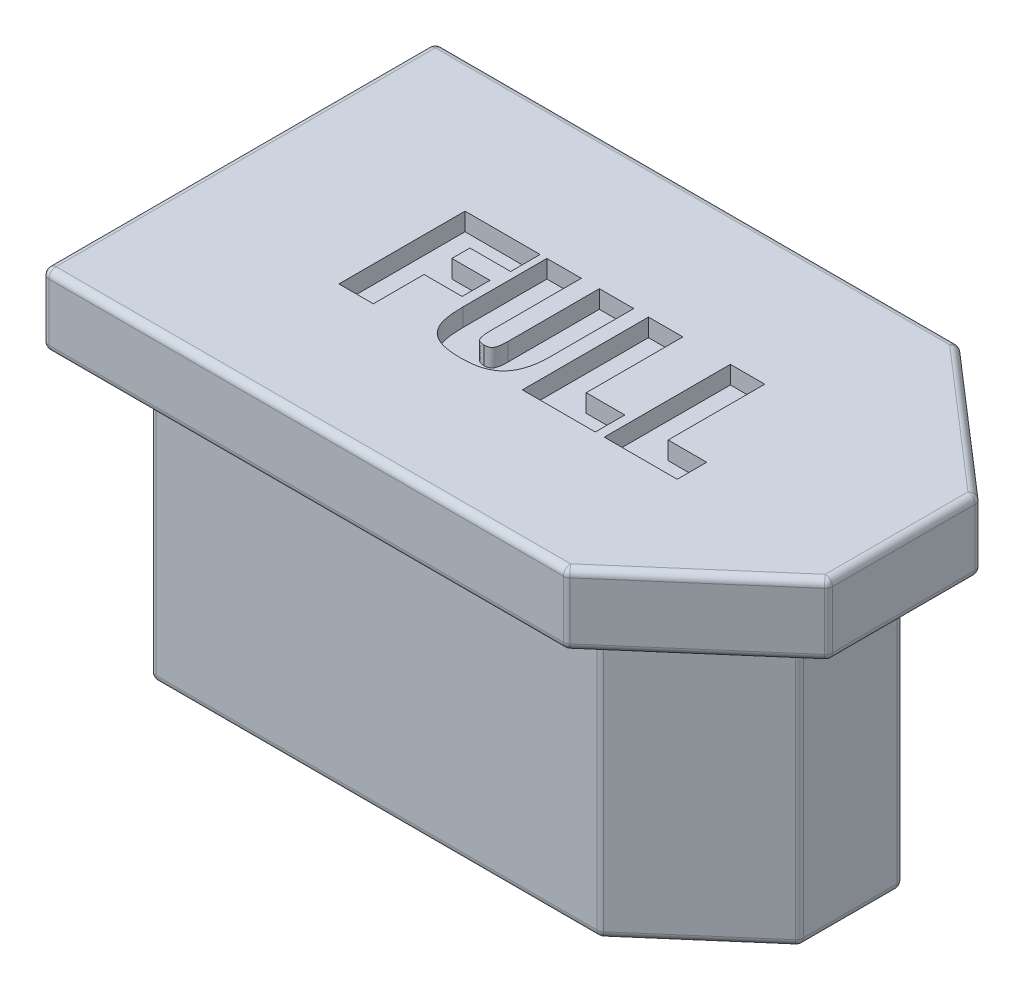
from build123d import *

# Parameters (mm, degrees)
BOSS_EXTRUDE1_DEPTH = 4
SHELL1_T            = -0.7
BOSS_EXTRUDE2_DEPTH = 2
BOSS_EXTRUDE4_REACH = 16.722
SKETCH4_W           = 2
SKETCH4_H           = 1.2
SKETCH5_W           = 1.1
SKETCH5_H           = 4
CUT_EXTRUDE1_DEPTH  = 1
FILLET1_R           = 0.2
CUT_EXTRUDE2_DEPTH  = 0.5


with BuildPart() as part:
    # Sketch1 → Boss-Extrude1 (new, symmetric)
    with BuildSketch(Plane(origin=(0, 0, 0), x_dir=(1, 0, 0), z_dir=(0, 1, 0))):
        Polygon((-7.800231879, 4), (4.799768121, 4), (7.800231879, 1.4), (7.800231879, -1.4), (4.799768121, -4), (-7.800231879, -4), align=None)
    extrude(amount=BOSS_EXTRUDE1_DEPTH, both=True)

    # Shell1
    shell1_openings = [part.faces().sort_by_distance(p)[0] for p in [
        (-0.453398861, 4, 0),
        (-0.453398861, -4, 0),
    ]]
    offset(amount=SHELL1_T, openings=shell1_openings, kind=Kind.INTERSECTION)

    # Sketch2 → Boss-Extrude2 (add)
    with BuildSketch(Plane(origin=(0, 4, 0), x_dir=(1, 0, 0), z_dir=(0, 1, 0))):
        Polygon((-9.300231879, 5.5), (-9.300231879, -5.5), (5.359252751, -5.5), (9.300231879, -2.085012665), (9.300231879, 2.085012665), (5.359252751, 5.5), align=None)
    extrude(amount=BOSS_EXTRUDE2_DEPTH)

    # Sketch4 → Boss-Extrude4 (add, up to next)
    with BuildSketch(Plane.XZ.offset(4), mode=Mode.PRIVATE) as boss_extrude4_sk1:
        with Locations((-0.100231879, -2.7)):
            Rectangle(SKETCH4_W, SKETCH4_H)
    boss_extrude4_tool1 = extrude(boss_extrude4_sk1.sketch, amount=-BOSS_EXTRUDE4_REACH, mode=Mode.PRIVATE) - part.part
    add(boss_extrude4_tool1.solids().sort_by_distance((-0.100232, -4, -2.7))[0])

    # Sketch5 → Cut-Extrude1 (cut)
    with BuildSketch(Plane.XZ.offset(-4)):
        with Locations((-0.100231879, -0.1)):
            Rectangle(SKETCH5_W, SKETCH5_H)
    extrude(amount=-CUT_EXTRUDE1_DEPTH, mode=Mode.SUBTRACT)

    # Fillet1
    fillet1_edges = [part.edges().sort_by_distance(p)[0] for p in [
        (6.3, 4, 2.7),
        (-7.800231879, 0, -4),
        (4.799768121, 0, -4),
        (7.800231879, 0, -1.4),
        (7.800231879, 0, 1.4),
        (4.799768121, 0, 4),
        (-7.800231879, 0, 4),
        (7.800231879, 4, 0),
        (6.3, 4, -2.7),
        (-1.500231879, 4, -4),
        (-7.100231879, -4, 0),
        (-7.100231879, 0, -3.3),
        (-1.280778293, -4, 3.3),
        (-7.100231879, 0, 3.3),
        (5.819453586, -4, 2.190163711),
        (4.538675293, 0, 3.3),
        (7.100231879, -4, 0),
        (7.100231879, 0, 1.080327423),
        (5.819453586, -4, -2.190163711),
        (7.100231879, 0, -1.080327423),
        (2.719221707, -4, -3.3),
        (4.538675293, 0, -3.3),
        (-7.100231879, 4, 0),
        (-1.280778293, 4, 3.3),
        (5.819453586, 4, 2.190163711),
        (7.100231879, 4, 0),
        (5.819453586, 4, -2.190163711),
        (2.719221707, 4, -3.3),
        (-1.970489564, 4, -5.5),
        (5.359252751, 5, -5.5),
        (-9.300231879, 4, 0),
        (-9.300231879, 5, -5.5),
        (-1.970489564, 4, 5.5),
        (-9.300231879, 5, 5.5),
        (7.329742315, 4, 3.792506333),
        (5.359252751, 5, 5.5),
        (9.300231879, 4, 0),
        (9.300231879, 5, 2.085012665),
        (7.329742315, 4, -3.792506333),
        (9.300231879, 5, -2.085012665),
        (-7.800231879, 4, 0),
        (-1.970489564, 6, -5.5),
        (-9.300231879, 6, 0),
        (-1.970489564, 6, 5.5),
        (7.329742315, 6, 3.792506333),
        (9.300231879, 6, 0),
        (7.329742315, 6, -3.792506333),
        (-4.100231879, 4, -3.3),
        (-1.500231879, -4, -4),
        (-4.100231879, -4, -3.3),
        (0.899768121, 0, -3.3),
        (-1.100231879, 4, -2.7),
        (-1.100231879, 0, -3.3),
        (0.674768121, 4, -2.1),
        (-1.100231879, 0, -2.1),
        (0.899768121, 4, -2.7),
        (0.899768121, 0, -2.1),
        (6.3, -4, -2.7),
        (0.899768121, -4, -2.7),
        (-0.100231879, -4, -2.1),
        (-1.100231879, -4, -2.7),
        (7.800231879, -4, 0),
        (-1.500231879, 4, 4),
        (6.3, -4, 2.7),
        (-0.875231879, 4, -2.1),
        (-1.500231879, -4, 4),
        (-0.100231879, 5, -2.1),
        (0.449768121, 4.5, -2.1),
        (-0.650231879, 5, -0.1),
        (-0.650231879, 4.5, -2.1),
        (-0.100231879, 5, 1.9),
        (-0.650231879, 4.5, 1.9),
        (0.449768121, 5, -0.1),
        (0.449768121, 4.5, 1.9),
        (0.449768121, 4, -0.1),
        (-0.100231879, 4, 1.9),
        (-0.650231879, 4, -0.1),
        (-7.800231879, -4, 0),
    ]]
    fillet(fillet1_edges, radius=FILLET1_R)

    # Sketch6 → Cut-Extrude2 (cut)
    with BuildSketch(Plane(origin=(0, 6, 0), x_dir=(1, 0, 0), z_dir=(0, 1, 0))):
        Polygon((-4.729610488, 1.763183333), (-2.630105658, 1.763183333), (-2.630105658, 0.938837879), (-3.767874124, 0.938837879), (-3.767874124, 0.435071212), (-2.704525734, 0.435071212), (-2.704525734, -0.343477273), (-3.767874124, -0.343477273), (-3.767874124, -1.763183333), (-4.729610488, -1.763183333), align=None)
        with BuildLine():
            Line((-0.974258973, 1.763183333), (-0.012522609, 1.763183333))
            Line((-0.012522609, 1.763183333), (-0.012522609, -0.582480208))
            add(Edge.make_bspline(
                [(-0.012522609, -0.582480208), (-0.013074538, -0.682044341), (-0.018871843, -0.827349384), (-0.050027891, -1.012483298), (-0.079237437, -1.137533649), (-0.118839295, -1.252460511), (-0.16648501, -1.357917428), (-0.224210632, -1.452631609), (-0.289561949, -1.538412572), (-0.365653341, -1.614171941), (-0.454278799, -1.678748395), (-0.554132011, -1.734173119), (-0.666295124, -1.777972128), (-0.789297045, -1.813476639), (-0.97670379, -1.845869926), (-1.124212944, -1.855100896), (-1.226142306, -1.854777273)],
                knots=[0, 0, 0, 0, 0.147091771, 0.213812555, 0.276818101, 0.336371325, 0.392915056, 0.447245077, 0.499696578, 0.551716391, 0.605080018, 0.661012388, 0.719773935, 0.782386932, 0.849634869, 1, 1, 1, 1], degree=3))
            add(Edge.make_bspline(
                [(-1.226142306, -1.854777273), (-1.335696933, -1.853598838), (-1.493540599, -1.848307146), (-1.691465292, -1.815233765), (-1.818090486, -1.783702772), (-1.930740252, -1.741372046), (-2.030450296, -1.687980633), (-2.118686541, -1.624868177), (-2.195040699, -1.550915118), (-2.259157986, -1.465805045), (-2.312988749, -1.370783365), (-2.356155802, -1.265216152), (-2.387752365, -1.148963406), (-2.410650726, -1.022432395), (-2.434574705, -0.832987442), (-2.439081919, -0.684631157), (-2.439762003, -0.582480208)],
                knots=[0, 0, 0, 0, 0.159500308, 0.228770628, 0.291433921, 0.348949481, 0.403253485, 0.455420347, 0.506186304, 0.557166208, 0.609816123, 0.664556878, 0.722530636, 0.784630014, 0.851388542, 1, 1, 1, 1], degree=3))
            Line((-2.439762003, -0.582480208), (-2.439762003, 1.763183333))
            Line((-2.439762003, 1.763183333), (-1.478025639, 1.763183333))
            Line((-1.478025639, 1.763183333), (-1.478025639, -0.784273106))
            add(Edge.make_bspline(
                [(-1.478025639, -0.784273106), (-1.47702952, -0.850008176), (-1.475898145, -0.94203407), (-1.453854653, -1.051706798), (-1.43524811, -1.112642268), (-1.403845733, -1.160637829), (-1.335235205, -1.205975479), (-1.270259157, -1.213013376), (-1.226142306, -1.213619697)],
                knots=[0, 0, 0, 0, 0.343473968, 0.475215467, 0.581631525, 0.673591657, 0.767279203, 1, 1, 1, 1], degree=3))
            add(Edge.make_bspline(
                [(-1.226142306, -1.213619697), (-1.182025455, -1.213013376), (-1.117049407, -1.205975479), (-1.048438879, -1.160637829), (-1.017036501, -1.112642268), (-0.998429959, -1.051706798), (-0.976386467, -0.94203407), (-0.975255092, -0.850008176), (-0.974258973, -0.784273106)],
                knots=[0, 0, 0, 0, 0.232720797, 0.326408343, 0.418368475, 0.524784533, 0.656526032, 1, 1, 1, 1], degree=3))
            Line((-0.974258973, -0.784273106), (-0.974258973, 1.763183333))
        make_face()
        Polygon((0.399650118, 1.763183333), (1.361386482, 1.763183333), (1.361386482, -0.938837879), (2.439762003, -0.938837879), (2.439762003, -1.763183333), (0.399650118, -1.763183333), align=None)
        Polygon((2.689498603, 1.763183333), (3.651234967, 1.763183333), (3.651234967, -0.938837879), (4.729610488, -0.938837879), (4.729610488, -1.763183333), (2.689498603, -1.763183333), align=None)
    extrude(amount=-CUT_EXTRUDE2_DEPTH, mode=Mode.SUBTRACT)


solid = part.part
